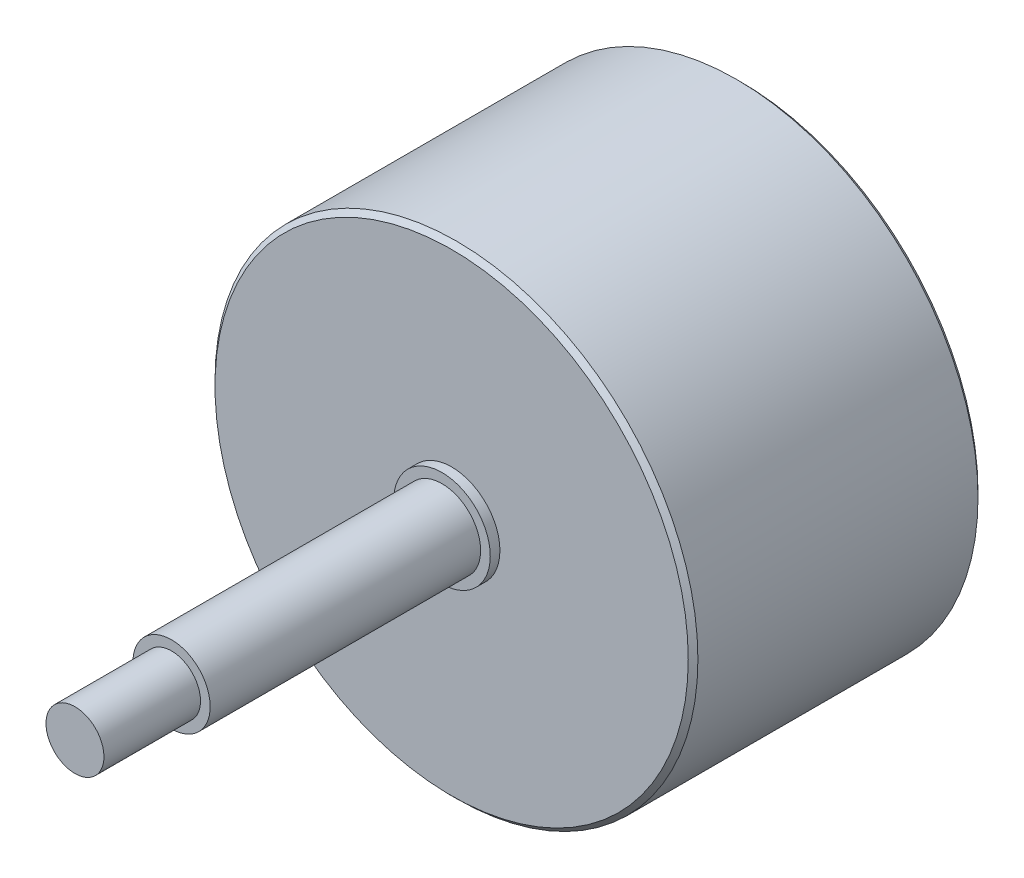
from build123d import *

# Parameters (mm, degrees)
ESQUISSE1_R             = 25
BOSS_EXTRU_1_DEPTH      = 30
ESQUISSE2_R             = 4
BOSS_EXTRU_2_DEPTH      = 39
ESQUISSE3_R             = 5
BOSS_EXTRU_3_DEPTH      = 1
ESQUISSE4_R             = 3
ENL_V_MAT_EXTRU_1_DEPTH = 10
CHANFREIN1_SIZE         = 0.5
ESQUISSE5_W             = 10
ESQUISSE5_H             = 1


with BuildPart() as part:
    # Esquisse1 → Boss.-Extru.1 (new body)
    with BuildSketch(Plane.XY):
        Circle(ESQUISSE1_R)
    extrude(amount=BOSS_EXTRU_1_DEPTH)

    # Esquisse2 → Boss.-Extru.2 (add)
    with BuildSketch(Plane.XY.offset(30)):
        Circle(ESQUISSE2_R)
    extrude(amount=BOSS_EXTRU_2_DEPTH)

    # Esquisse3 → Boss.-Extru.3 (add)
    with BuildSketch(Plane.XY.offset(30)):
        Circle(ESQUISSE3_R)
    extrude(amount=BOSS_EXTRU_3_DEPTH)

    # Esquisse4 → Enlèv. mat.-Extru.1 (cut)
    with BuildSketch(Plane(origin=(0, 0, 0), x_dir=(-1, 0, 0), z_dir=(0, 0, -1))):
        Circle(ESQUISSE4_R)
    extrude(amount=-ENL_V_MAT_EXTRU_1_DEPTH, mode=Mode.SUBTRACT)

    # Chanfrein1
    chanfrein1_edges = [part.edges().sort_by_distance(p)[0] for p in [
        (-25, 0, 0),
        (-25, 0, 30),
        (-4, 0, 69),
    ]]
    chamfer(chanfrein1_edges, length=CHANFREIN1_SIZE)

    # Esquisse5 → Enlèvement de matière-Révolution1 (revolve, cut)
    with BuildSketch(Plane(origin=(0, 0, 0), x_dir=(0, 0, -1), z_dir=(1, 0, 0)), mode=Mode.PRIVATE) as enl_vement_de_mati_re_r_volution1_sk:
        with Locations((-64, 3.5)):
            Rectangle(ESQUISSE5_W, ESQUISSE5_H)
    revolve(enl_vement_de_mati_re_r_volution1_sk.sketch.rotate(Axis((0, 0, 69), (0, 0, -1)), 180), axis=Axis((0, 0, 69), (0, 0, -1)), mode=Mode.SUBTRACT)


solid = part.part
